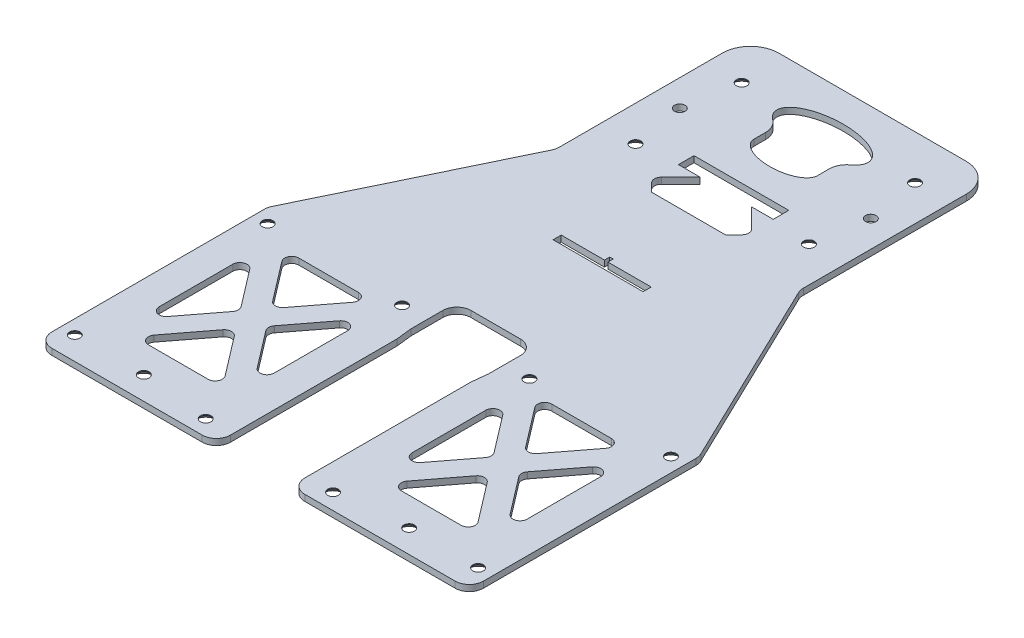
from build123d import *

# Parameters (mm, degrees)
BOSS_EXTRUDE1_DEPTH = 1.75
SKETCH2_R           = 1.5
CUT_EXTRUDE1_DEPTH  = 1.75
FILLET1_R           = 4
FILLET2_R           = 2
CHAMFER1_SIZE       = 1.5
FILLET3_R           = 8


with BuildPart() as part:
    # Sketch1 → Boss-Extrude1 (new body)
    with BuildSketch(Plane(origin=(0, 0, 0), x_dir=(1, 0, 0), z_dir=(0, 1, 0))):
        Polygon((10.5, 0), (61, 0), (61, 65), (34.5, 120), (34.5, 175), (-34.5, 175), (-34.5, 120), (-61, 65), (-61, 0), (-10.5, 0), (-10.5, 51), (-11, 55.5), (-11, 68.5), (11, 68.5), (11, 55.5), (10.5, 51), align=None)
    extrude(amount=BOSS_EXTRUDE1_DEPTH)

    # Sketch2 → Cut-Extrude1 (cut)
    with BuildSketch(Plane(origin=(0, 1.75, 0), x_dir=(1, 0, 0), z_dir=(0, 1, 0))):
        with Locations(Location((18, 60, 0), (0, 0, 270))):
            Circle(SKETCH2_R)
        with Locations(Location((18, 4.5, 0), (0, 0, 270))):
            Circle(SKETCH2_R)
        with Locations(Location((37.5, 6.5, 0), (0, 0, 270))):
            Circle(SKETCH2_R)
        with Locations(Location((57, 6.5, 0), (0, 0, 270))):
            Circle(SKETCH2_R)
        with Locations(Location((57, 61, 0), (0, 0, 270))):
            Circle(SKETCH2_R)
        with Locations(Location((-57, 6.5, 0), (0, 0, 270))):
            Circle(SKETCH2_R)
        with Locations(Location((-37.5, 6.5, 0), (0, 0, 270))):
            Circle(SKETCH2_R)
        with Locations(Location((-18, 4.5, 0), (0, 0, 270))):
            Circle(SKETCH2_R)
        with Locations(Location((-57, 61, 0), (0, 0, 270))):
            Circle(SKETCH2_R)
        with Locations(Location((-18, 60, 0), (0, 0, 270))):
            Circle(SKETCH2_R)
        with Locations(Location((24.5, 162.5, 0), (0, 0, 270))):
            Circle(SKETCH2_R)
        with Locations(Location((24.5, 132.5, 0), (0, 0, 270))):
            Circle(SKETCH2_R)
        with Locations(Location((27, 147.5, 0), (0, 0, 270))):
            Circle(SKETCH2_R)
        with Locations(Location((-24.5, 132.5, 0), (0, 0, 270))):
            Circle(SKETCH2_R)
        with Locations(Location((-27, 147.5, 0), (0, 0, 270))):
            Circle(SKETCH2_R)
        with Locations(Location((-24.5, 162.5, 0), (0, 0, 270))):
            Circle(SKETCH2_R)
        Polygon((23.27663551, 57), (48.22336449, 57), (35.75, 40.688677206), align=None)
        Polygon((19.5, 52.061322794), (19.5, 19.438677206), (31.97336449, 35.75), align=None)
        Polygon((23.27663551, 14.5), (48.22336449, 14.5), (35.75, 30.811322794), align=None)
        Polygon((52, 52.061322794), (52, 19.438677206), (39.52663551, 35.75), align=None)
        Polygon((-31.97336449, 35.75), (-19.5, 19.438677206), (-19.5, 52.061322794), align=None)
        Polygon((-23.27663551, 57), (-35.75, 40.688677206), (-48.22336449, 57), align=None)
        Polygon((-52, 52.061322794), (-39.52663551, 35.75), (-52, 19.438677206), align=None)
        Polygon((-35.75, 30.811322794), (-48.22336449, 14.5), (-23.27663551, 14.5), align=None)
        with BuildLine():
            Line((-8.956849663, 150.448814465), (-8.956849663, 153.745757652))
            ThreePointArc((-8.956849663, 153.745757652), (-9.489230508, 155.990836511), (-10.973001296, 157.757820578))
            add(Edge.make_bspline(
                [(10.973001296, 157.757820578), (23.010145552, 166.710076287), (0, 166.710076287), (-23.010145552, 166.710076287), (-10.973001296, 157.757820578)],
                knots=[5.732673671, 5.732673671, 5.732673671, 7.853981634, 7.853981634, 9.975289597, 9.975289597, 9.975289597], degree=2, weights=[1, 0.488301473, 1, 0.488301473, 1]))
            ThreePointArc((10.973001296, 157.757820578), (9.489230508, 155.990836511), (8.956849663, 153.745757652))
            Line((8.956849663, 153.745757652), (8.956849663, 150.448814465))
            add(Edge.make_bspline(
                [(-8.956849663, 150.448814465), (-8.956849663, 145.942681671), (0, 145.942681671), (8.956849663, 145.942681671), (8.956849663, 150.448814465)],
                knots=[3.141592654, 3.141592654, 3.141592654, 4.71238898, 4.71238898, 6.283185307, 6.283185307, 6.283185307], degree=2, weights=[1, 0.707106781, 1, 0.707106781, 1]))
        make_face()
        with BuildLine():
            Line((-10.429909879, 122.969105581), (10.429909879, 122.969105581))
            Line((10.429909879, 122.969105581), (12.712876837, 125.252072539))
            ThreePointArc((12.712876837, 125.252072539), (13.298663275, 126.666286101), (12.712876837, 128.080499664))
            Line((12.712876837, 128.080499664), (7.277248064, 133.516128436))
            Line((7.277248064, 133.516128436), (13.393504779, 133.516128436))
            Line((13.393504779, 133.516128436), (13.393504779, 137.910010169))
            Line((13.393504779, 137.910010169), (-13.393504779, 137.910010169))
            Line((-13.393504779, 137.910010169), (-13.393504779, 133.516128436))
            Line((-13.393504779, 133.516128436), (-7.277248064, 133.516128436))
            Line((-7.277248064, 133.516128436), (-12.712876837, 128.080499664))
            ThreePointArc((-12.712876837, 128.080499664), (-13.298663275, 126.666286101), (-12.712876837, 125.252072539))
            Line((-12.712876837, 125.252072539), (-10.429909879, 122.969105581))
        make_face()
        Polygon((-12.712876837, 97.412371196), (12.712876837, 97.412371196), (12.712876837, 99.69809073), (0.491409148, 99.69809073), (0.491409148, 101.193074922), (-0.491409148, 101.193074922), (-0.491409148, 99.69809073), (-12.712876837, 99.69809073), align=None)
    extrude(amount=-CUT_EXTRUDE1_DEPTH, mode=Mode.SUBTRACT)

    # Fillet1
    fillet1_edges = [part.edges().sort_by_distance(p)[0] for p in [
        (11, 0.875, -68.5),
        (-11, 0.875, -68.5),
        (-10.5, 0.875, 0),
        (-61, 0.875, 0),
        (-61, 0.875, -65),
        (-34.5, 0.875, -120),
        (34.5, 0.875, -120),
        (61, 0.875, -65),
        (61, 0.875, 0),
        (10.5, 0.875, 0),
    ]]
    fillet(fillet1_edges, radius=FILLET1_R)

    # Fillet2
    fillet2_edges = [part.edges().sort_by_distance(p)[0] for p in [
        (39.52663551, 0.875, -35.75),
        (52, 0.875, -52.061322794),
        (52, 0.875, -19.438677206),
        (-48.22336449, 0.875, -57),
        (-23.27663551, 0.875, -57),
        (-35.75, 0.875, -40.688677206),
        (48.22336449, 0.875, -57),
        (35.75, 0.875, -40.688677206),
        (23.27663551, 0.875, -57),
        (-52, 0.875, -19.438677206),
        (-52, 0.875, -52.061322794),
        (-39.52663551, 0.875, -35.75),
        (-35.75, 0.875, -30.811322794),
        (-23.27663551, 0.875, -14.5),
        (-48.22336449, 0.875, -14.5),
        (31.97336449, 0.875, -35.75),
        (19.5, 0.875, -19.438677206),
        (19.5, 0.875, -52.061322794),
        (35.75, 0.875, -30.811322794),
        (48.22336449, 0.875, -14.5),
        (23.27663551, 0.875, -14.5),
        (-31.97336449, 0.875, -35.75),
        (-19.5, 0.875, -52.061322794),
        (-19.5, 0.875, -19.438677206),
    ]]
    fillet(fillet2_edges, radius=FILLET2_R)

    # Chamfer1
    chamfer1_edges = [part.edges().sort_by_distance(p)[0] for p in [
        (-57, 0, -8),
        (-37.5, 0, -8),
        (-18, 0, -6),
        (-57, 0, -62.5),
        (-18, 0, -61.5),
        (24.5, 0, -164),
        (24.5, 0, -134),
        (-24.5, 0, -134),
        (-24.5, 0, -164),
        (18, 0, -61.5),
        (18, 0, -6),
        (37.5, 0, -8),
        (57, 0, -8),
        (57, 0, -62.5),
    ]]
    chamfer(chamfer1_edges, length=CHAMFER1_SIZE)

    # Fillet3
    fillet3_edges = [part.edges().sort_by_distance(p)[0] for p in [
        (-34.5, 0.875, -175),
        (34.5, 0.875, -175),
    ]]
    fillet(fillet3_edges, radius=FILLET3_R)


solid = part.part
